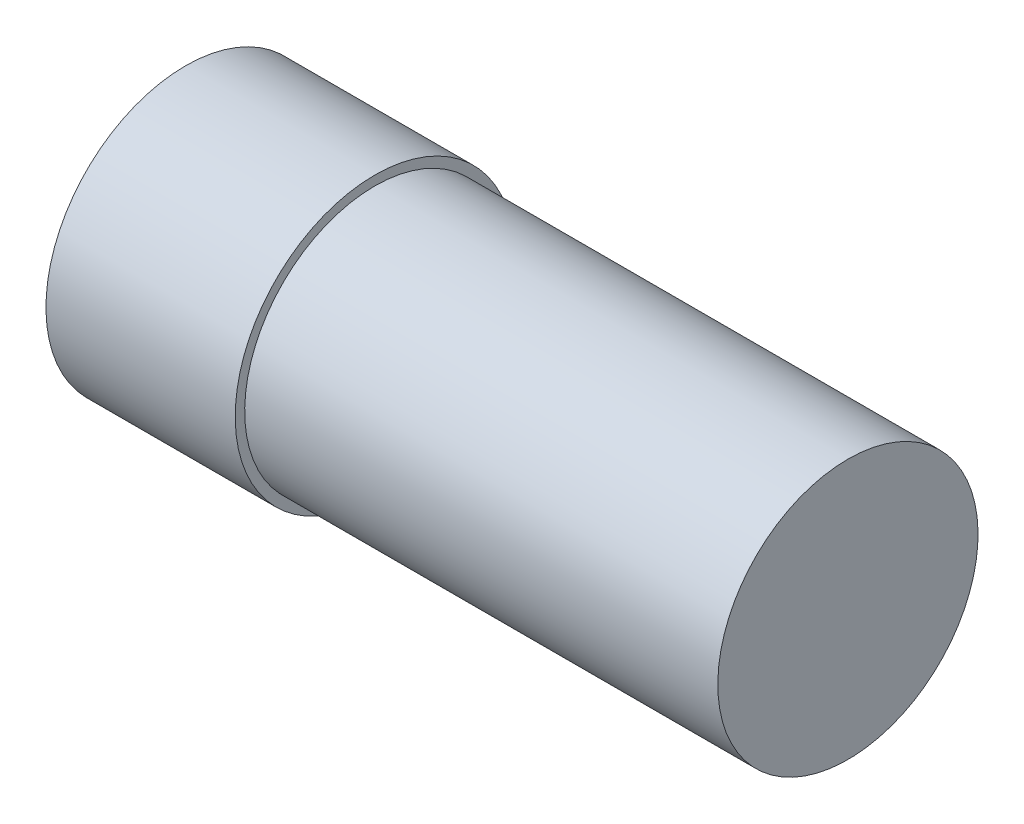
from build123d import *


with BuildPart() as part:
    # Esquisse1 → Révolution1 (revolve)
    with BuildSketch(Plane.XY):
        Polygon((0, 0), (0, 29.5), (40, 29.5), (40, 27.5), (140, 27.5), (140, 0), align=None)
    revolve(axis=Axis((140, 0, 0), (-1, 0, 0)))


solid = part.part
